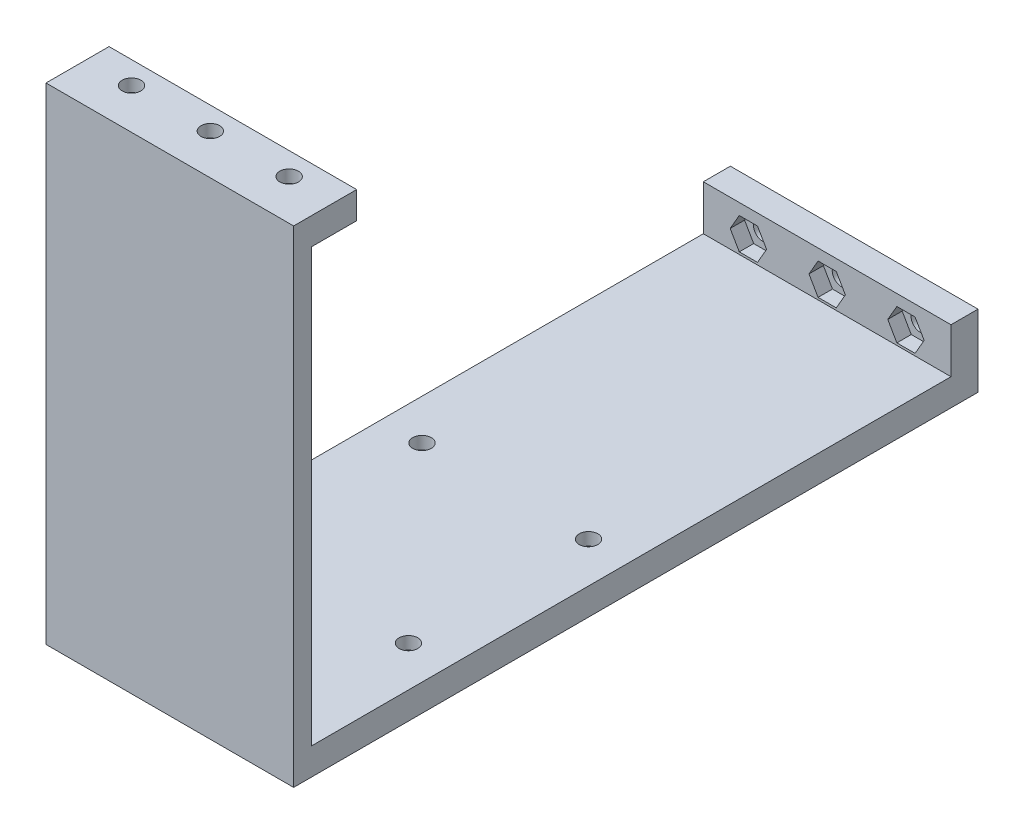
from build123d import *

# Parameters (mm, degrees)
BOSS_EXTRUDE1_DEPTH = 55
CUT_EXTRUDE1_REACH  = 193.293
SKETCH2_R           = 2.075
CUT_EXTRUDE2_REACH  = 196.404
SKETCH3_R           = 2.075
CUT_EXTRUDE3_DEPTH  = 3.2
CUT_EXTRUDE4_DEPTH  = 3.2
CUT_EXTRUDE5_REACH  = 193.293
SKETCH6_R           = 2.075
CUT_EXTRUDE6_DEPTH  = 3.2


with BuildPart() as part:
    # Sketch1 → Boss-Extrude1 (new body)
    with BuildSketch(Plane(origin=(0, 0, 0), x_dir=(0, 0, -1), z_dir=(1, 0, 0))):
        Polygon((0, -102), (0, -6), (10, -6), (10, 0), (0, 0), (-4, 0), (-4, -108), (148, -108), (148, -92), (142, -92), (142, -102), align=None)
    extrude(amount=BOSS_EXTRUDE1_DEPTH)

    # Sketch2 → Cut-Extrude1 (cut, up to next)
    with BuildSketch(Plane(origin=(0, 0, 0), x_dir=(1, 0, 0), z_dir=(0, 1, 0)), mode=Mode.PRIVATE) as cut_extrude1_sk1:
        with Locations(Location((10, 5, 0), (0, 0, 270))):
            Circle(SKETCH2_R)
    cut_extrude1_tool1 = extrude(cut_extrude1_sk1.sketch, amount=-CUT_EXTRUDE1_REACH, mode=Mode.PRIVATE) & part.part
    # Sketch2 → Cut-Extrude1 (cut, up to next)
    with BuildSketch(Plane(origin=(0, 0, 0), x_dir=(1, 0, 0), z_dir=(0, 1, 0)), mode=Mode.PRIVATE) as cut_extrude1_sk2:
        with Locations(Location((27.5, 5, 0), (0, 0, 270))):
            Circle(SKETCH2_R)
    cut_extrude1_tool2 = extrude(cut_extrude1_sk2.sketch, amount=-CUT_EXTRUDE1_REACH, mode=Mode.PRIVATE) & part.part
    # Sketch2 → Cut-Extrude1 (cut, up to next)
    with BuildSketch(Plane(origin=(0, 0, 0), x_dir=(1, 0, 0), z_dir=(0, 1, 0)), mode=Mode.PRIVATE) as cut_extrude1_sk3:
        with Locations(Location((45, 5, 0), (0, 0, 270))):
            Circle(SKETCH2_R)
    cut_extrude1_tool3 = extrude(cut_extrude1_sk3.sketch, amount=-CUT_EXTRUDE1_REACH, mode=Mode.PRIVATE) & part.part
    add(cut_extrude1_tool1.solids().sort_by_distance((10, 0, -5))[0], mode=Mode.SUBTRACT)
    add(cut_extrude1_tool2.solids().sort_by_distance((27.5, 0, -5))[0], mode=Mode.SUBTRACT)
    add(cut_extrude1_tool3.solids().sort_by_distance((45, 0, -5))[0], mode=Mode.SUBTRACT)

    # Sketch3 → Cut-Extrude2 (cut, up to next)
    with BuildSketch(Plane(origin=(0, 0, -148), x_dir=(-1, 0, 0), z_dir=(0, 0, -1)), mode=Mode.PRIVATE) as cut_extrude2_sk1:
        with Locations(Location((-45, -98, 0), (0, 0, 90))):
            Circle(SKETCH3_R)
    cut_extrude2_tool1 = extrude(cut_extrude2_sk1.sketch, amount=-CUT_EXTRUDE2_REACH, mode=Mode.PRIVATE) & part.part
    # Sketch3 → Cut-Extrude2 (cut, up to next)
    with BuildSketch(Plane(origin=(0, 0, -148), x_dir=(-1, 0, 0), z_dir=(0, 0, -1)), mode=Mode.PRIVATE) as cut_extrude2_sk2:
        with Locations(Location((-27.5, -98, 0), (0, 0, 90))):
            Circle(SKETCH3_R)
    cut_extrude2_tool2 = extrude(cut_extrude2_sk2.sketch, amount=-CUT_EXTRUDE2_REACH, mode=Mode.PRIVATE) & part.part
    # Sketch3 → Cut-Extrude2 (cut, up to next)
    with BuildSketch(Plane(origin=(0, 0, -148), x_dir=(-1, 0, 0), z_dir=(0, 0, -1)), mode=Mode.PRIVATE) as cut_extrude2_sk3:
        with Locations(Location((-10, -98, 0), (0, 0, 90))):
            Circle(SKETCH3_R)
    cut_extrude2_tool3 = extrude(cut_extrude2_sk3.sketch, amount=-CUT_EXTRUDE2_REACH, mode=Mode.PRIVATE) & part.part
    add(cut_extrude2_tool1.solids().sort_by_distance((45, -98, -148))[0], mode=Mode.SUBTRACT)
    add(cut_extrude2_tool2.solids().sort_by_distance((27.5, -98, -148))[0], mode=Mode.SUBTRACT)
    add(cut_extrude2_tool3.solids().sort_by_distance((10, -98, -148))[0], mode=Mode.SUBTRACT)

    # Sketch4 → Cut-Extrude3 (cut)
    with BuildSketch(Plane.XZ.offset(6)):
        Polygon((49.041451884, -5), (47.020725942, -1.5), (42.979274058, -1.5), (40.958548116, -5), (42.979274058, -8.5), (47.020725942, -8.5), align=None)
        Polygon((29.520725942, -8.5), (31.541451884, -5), (29.520725942, -1.5), (25.479274058, -1.5), (23.458548116, -5), (25.479274058, -8.5), align=None)
        Polygon((14.041451884, -5), (12.020725942, -1.5), (7.979274058, -1.5), (5.958548116, -5), (7.979274058, -8.5), (12.020725942, -8.5), align=None)
    extrude(amount=-CUT_EXTRUDE3_DEPTH, mode=Mode.SUBTRACT)

    # Sketch5 → Cut-Extrude4 (cut)
    with BuildSketch(Plane.XY.offset(-142)):
        Polygon((14.041451884, -98), (12.020725942, -94.5), (7.979274058, -94.5), (5.958548116, -98), (7.979274058, -101.5), (12.020725942, -101.5), align=None)
        Polygon((31.541451884, -98), (29.520725942, -94.5), (25.479274058, -94.5), (23.458548116, -98), (25.479274058, -101.5), (29.520725942, -101.5), align=None)
        Polygon((47.020725942, -101.5), (49.041451884, -98), (47.020725942, -94.5), (42.979274058, -94.5), (40.958548116, -98), (42.979274058, -101.5), align=None)
    extrude(amount=-CUT_EXTRUDE4_DEPTH, mode=Mode.SUBTRACT)

    # Sketch6 → Cut-Extrude5 (cut, up to next)
    with BuildSketch(Plane.XZ.offset(108), mode=Mode.PRIVATE) as cut_extrude5_sk1:
        with Locations(Location((46, -30.5, 0), (0, 0, 270))):
            Circle(SKETCH6_R)
    cut_extrude5_tool1 = extrude(cut_extrude5_sk1.sketch, amount=-CUT_EXTRUDE5_REACH, mode=Mode.PRIVATE) & part.part
    # Sketch6 → Cut-Extrude5 (cut, up to next)
    with BuildSketch(Plane.XZ.offset(108), mode=Mode.PRIVATE) as cut_extrude5_sk2:
        with Locations(Location((46, -70.5, 0), (0, 0, 270))):
            Circle(SKETCH6_R)
    cut_extrude5_tool2 = extrude(cut_extrude5_sk2.sketch, amount=-CUT_EXTRUDE5_REACH, mode=Mode.PRIVATE) & part.part
    # Sketch6 → Cut-Extrude5 (cut, up to next)
    with BuildSketch(Plane.XZ.offset(108), mode=Mode.PRIVATE) as cut_extrude5_sk3:
        with Locations(Location((9, -70.5, 0), (0, 0, 270))):
            Circle(SKETCH6_R)
    cut_extrude5_tool3 = extrude(cut_extrude5_sk3.sketch, amount=-CUT_EXTRUDE5_REACH, mode=Mode.PRIVATE) & part.part
    # Sketch6 → Cut-Extrude5 (cut, up to next)
    with BuildSketch(Plane.XZ.offset(108), mode=Mode.PRIVATE) as cut_extrude5_sk4:
        with Locations(Location((9, -30.5, 0), (0, 0, 270))):
            Circle(SKETCH6_R)
    cut_extrude5_tool4 = extrude(cut_extrude5_sk4.sketch, amount=-CUT_EXTRUDE5_REACH, mode=Mode.PRIVATE) & part.part
    add(cut_extrude5_tool1.solids().sort_by_distance((46, -108, -30.5))[0], mode=Mode.SUBTRACT)
    add(cut_extrude5_tool2.solids().sort_by_distance((46, -108, -70.5))[0], mode=Mode.SUBTRACT)
    add(cut_extrude5_tool3.solids().sort_by_distance((9, -108, -70.5))[0], mode=Mode.SUBTRACT)
    add(cut_extrude5_tool4.solids().sort_by_distance((9, -108, -30.5))[0], mode=Mode.SUBTRACT)

    # Sketch7 → Cut-Extrude6 (cut)
    with BuildSketch(Plane.XZ.offset(108)):
        Polygon((48.020725942, -27), (43.979274058, -27), (41.958548116, -30.5), (43.979274058, -34), (48.020725942, -34), (50.041451884, -30.5), align=None)
        Polygon((43.979274058, -74), (48.020725942, -74), (50.041451884, -70.5), (48.020725942, -67), (43.979274058, -67), (41.958548116, -70.5), align=None)
        Polygon((13.041451884, -70.5), (11.020725942, -74), (6.979274058, -74), (4.958548116, -70.5), (6.979274058, -67), (11.020725942, -67), align=None)
        Polygon((4.958548116, -30.5), (6.979274058, -27), (11.020725942, -27), (13.041451884, -30.5), (11.020725942, -34), (6.979274058, -34), align=None)
    extrude(amount=-CUT_EXTRUDE6_DEPTH, mode=Mode.SUBTRACT)


solid = part.part
